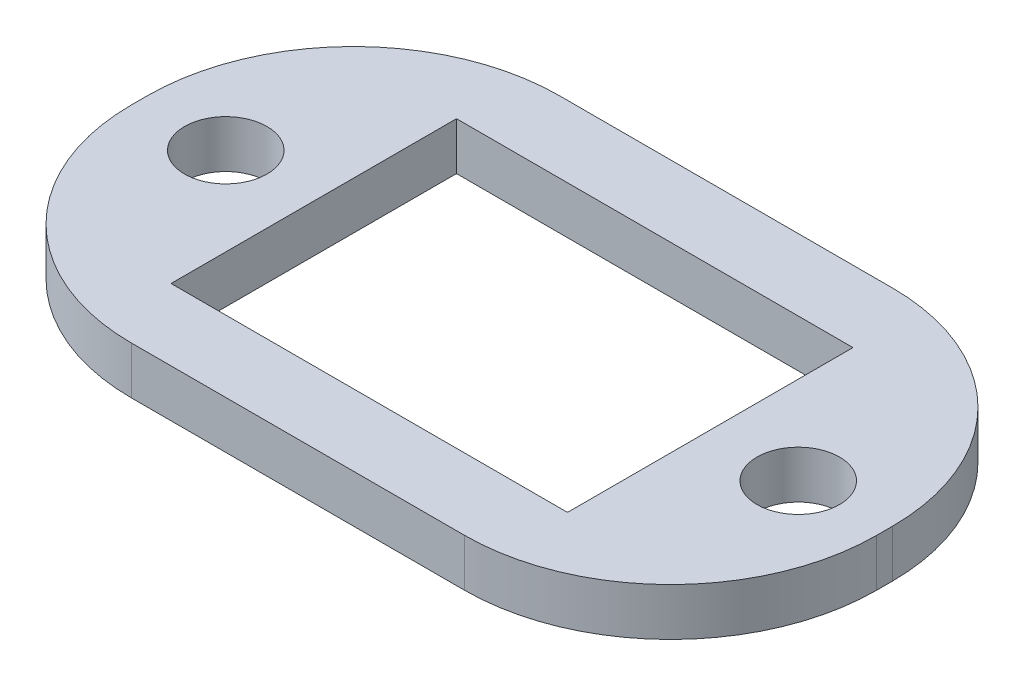
from build123d import *

# Parameters (mm, degrees)
SKETCH1_R           = 2.6
SKETCH1_W           = 25
SKETCH1_H           = 18
BOSS_EXTRUDE1_DEPTH = 3


with BuildPart() as part:
    # Sketch1 → Boss-Extrude1 (new body)
    with BuildSketch(Plane(origin=(0, 0, 0), x_dir=(1, 0, 0), z_dir=(0, 1, 0))):
        with BuildLine():
            Line((-10.5, 13.5), (10.5, 13.5))
            ThreePointArc((10.5, 13.5), (19.692388155, 9.692388155), (23.5, 0.5))
            Line((23.5, 0.5), (23.5, -0.5))
            ThreePointArc((23.5, -0.5), (19.692388155, -9.692388155), (10.5, -13.5))
            Line((10.5, -13.5), (-10.5, -13.5))
            ThreePointArc((-10.5, -13.5), (-19.692388155, -9.692388155), (-23.5, -0.5))
            Line((-23.5, -0.5), (-23.5, 0.5))
            ThreePointArc((-23.5, 0.5), (-19.692388155, 9.692388155), (-10.5, 13.5))
        make_face()
        with Locations(Location((18.05, 0, 0), (0, 0, 270))):
            Circle(SKETCH1_R, mode=Mode.SUBTRACT)
        with Locations(Location((-18.05, 0, 0), (0, 0, 90))):
            Circle(SKETCH1_R, mode=Mode.SUBTRACT)
        Rectangle(SKETCH1_W, SKETCH1_H, mode=Mode.SUBTRACT)
    extrude(amount=BOSS_EXTRUDE1_DEPTH)


solid = part.part
